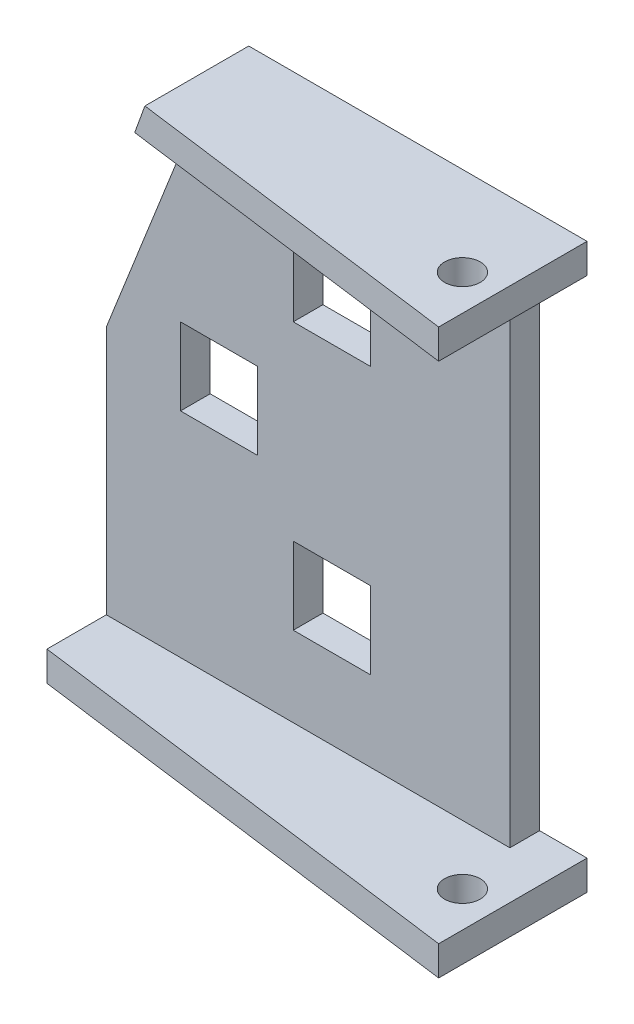
from build123d import *

# Parameters (mm, degrees)
BOSS_EXTRUDE1_DEPTH = 5
SKETCH2_W           = 13
SKETCH2_H           = 13
CUT_EXTRUDE1_DEPTH  = 119.11011811
SKETCH5_W           = 76
SKETCH5_H           = 5
BOSS_EXTRUDE3_DEPTH = 20
CUT_EXTRUDE2_DEPTH  = 121.623380818
SKETCH7_R           = 3
CUT_EXTRUDE4_DEPTH  = 121.623380818
SKETCH8_W           = 8
SKETCH8_H           = 85
CUT_EXTRUDE5_DEPTH  = 120.687092036


with BuildPart() as part:
    # Sketch1 → Boss-Extrude1 (new body)
    with BuildSketch(Plane.XY):
        Polygon((-70, 0), (6, 0), (6, 95), (-51, 95), (-70, 47), align=None)
    extrude(amount=BOSS_EXTRUDE1_DEPTH)

    # Sketch2 → Cut-Extrude1 (cut, through all)
    with BuildSketch(Plane.XY.offset(5)):
        with Locations((-32, 70)):
            Rectangle(SKETCH2_W, SKETCH2_H)
        with Locations((-32, 25)):
            Rectangle(SKETCH2_W, SKETCH2_H)
        with Locations((-51, 47.5)):
            Rectangle(SKETCH2_W, SKETCH2_H)
    extrude(amount=-CUT_EXTRUDE1_DEPTH, mode=Mode.SUBTRACT)

    # Sketch5 → Boss-Extrude3 (add)
    with BuildSketch(Plane.XY.offset(5)):
        Polygon((-51, 95), (-52.979166667, 90), (6, 90), (6, 95), align=None)
        with Locations((-32, 2.5)):
            Rectangle(SKETCH5_W, SKETCH5_H)
    extrude(amount=BOSS_EXTRUDE3_DEPTH)

    # Sketch6 → Cut-Extrude2 (cut, through all)
    with BuildSketch(Plane.XZ):
        Polygon((6, 25), (-70, 15), (-70, 25), align=None)
    extrude(amount=-CUT_EXTRUDE2_DEPTH, mode=Mode.SUBTRACT)

    # Sketch7 → Cut-Extrude4 (cut, through all)
    with BuildSketch(Plane(origin=(0, 95, 0), x_dir=(1, 0, 0), z_dir=(0, 1, 0))):
        with Locations(Location((0, -15, 0), (0, 0, 180))):
            Circle(SKETCH7_R)
    extrude(amount=-CUT_EXTRUDE4_DEPTH, mode=Mode.SUBTRACT)

    # Sketch8 → Cut-Extrude5 (cut, through all)
    with BuildSketch(Plane.XY.offset(5)):
        with Locations((2, 47.5)):
            Rectangle(SKETCH8_W, SKETCH8_H)
    extrude(amount=-CUT_EXTRUDE5_DEPTH, mode=Mode.SUBTRACT)


solid = part.part
